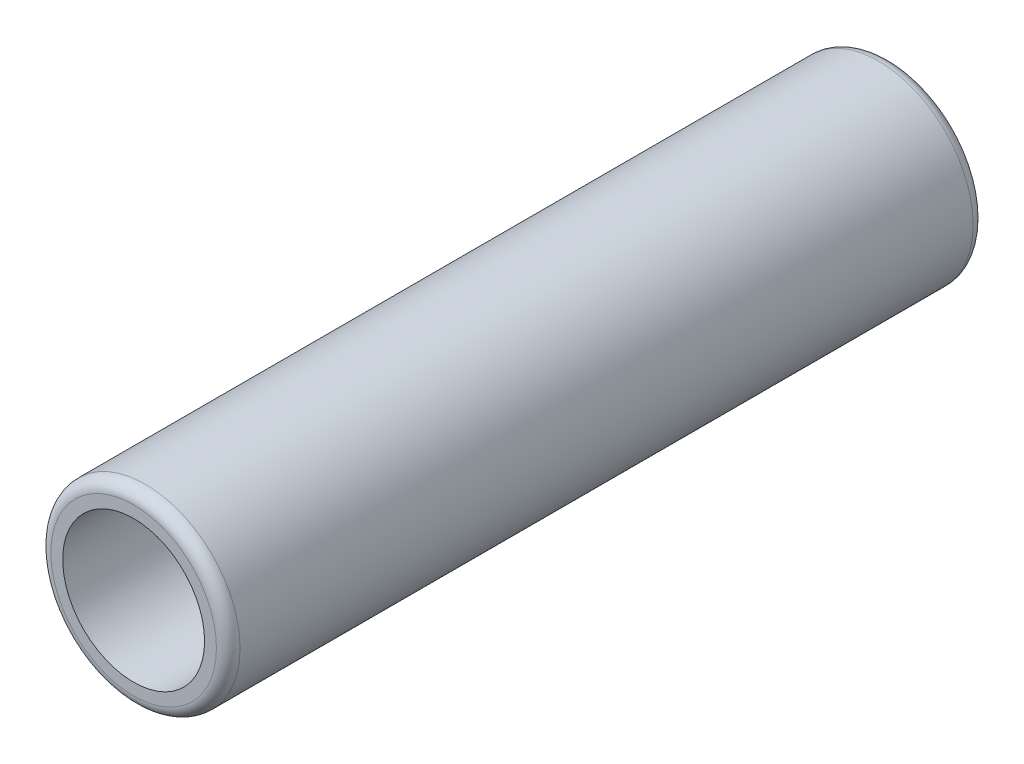
from build123d import *

# Parameters (mm, degrees)
SKETCH_1_R      = 4
SKETCH_1_R_2    = 3
EXTRUDE_1_DEPTH = 32
FILLET_1_R      = 0.5


with BuildPart() as part:
    # Эскиз1 → Бобышка-Вытянуть1 (new body)
    with BuildSketch(Plane.XY):
        Circle(SKETCH_1_R)
        Circle(SKETCH_1_R_2, mode=Mode.SUBTRACT)
    extrude(amount=EXTRUDE_1_DEPTH)

    # Скругление1
    fillet_1_edges = [part.edges().sort_by_distance(p)[0] for p in [
        (-4, 0, 0),
        (-4, 0, 32),
    ]]
    fillet(fillet_1_edges, radius=FILLET_1_R)


solid = part.part
